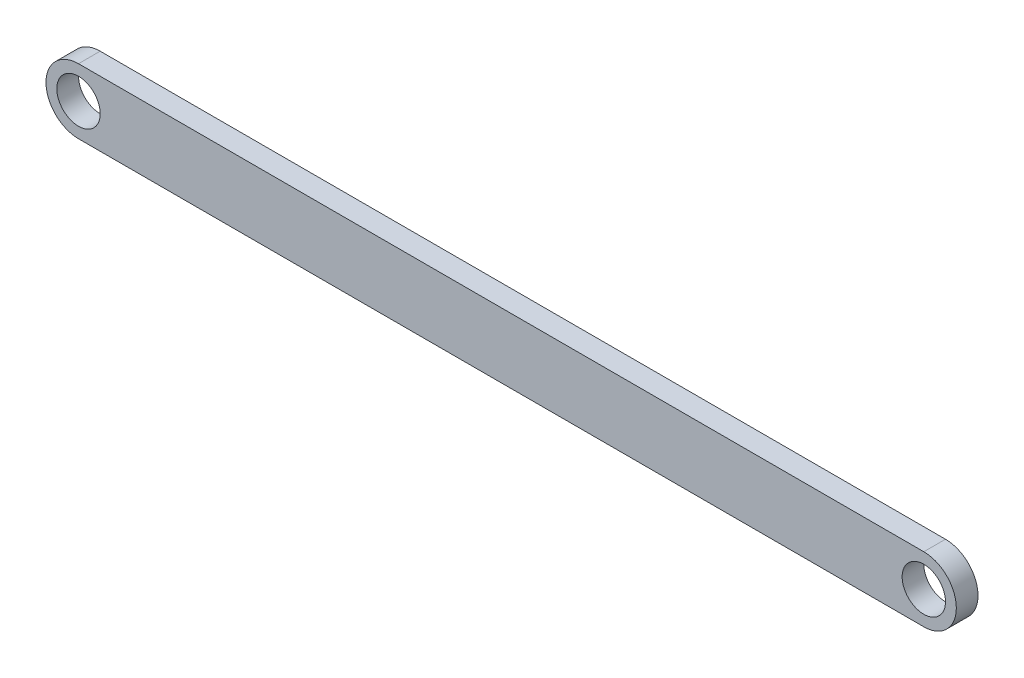
from build123d import *

# Parameters (mm, degrees)
SKETCH_1_R      = 10
EXTRUDE_1_DEPTH = 10


with BuildPart() as part:
    # Эскиз1 → Бобышка-Вытянуть1 (new body)
    with BuildSketch(Plane.XY):
        with BuildLine():
            Line((0, 15), (390, 15))
            ThreePointArc((390, 15), (405, 0), (390, -15))
            Line((390, -15), (0, -15))
            ThreePointArc((0, -15), (-15, 0), (0, 15))
        make_face()
        Circle(SKETCH_1_R, mode=Mode.SUBTRACT)
        with Locations((390, 0)):
            Circle(SKETCH_1_R, mode=Mode.SUBTRACT)
    extrude(amount=EXTRUDE_1_DEPTH)


solid = part.part
